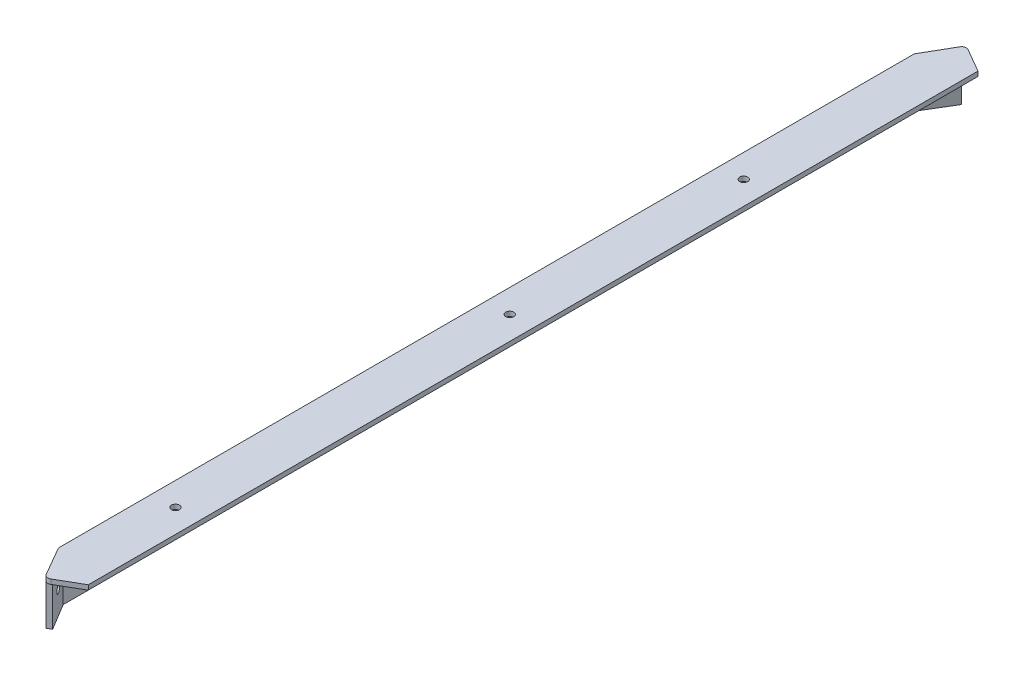
from build123d import *

# Parameters (mm, degrees)
BOSS_EXTRUDE1_DEPTH = 640
BOSS_EXTRUDE2_DEPTH = 63
BOSS_EXTRUDE4_DEPTH = 7
SKETCH10_R          = 6
CUT_EXTRUDE3_DEPTH  = 7
FILLET5_R           = 5
SKETCH22_R          = 6
CUT_EXTRUDE4_DEPTH  = 335


with BuildPart() as part:
    # Sketch1 → Boss-Extrude1 (new body)
    with BuildSketch(Plane.XY):
        Polygon((0, 0), (0, 70), (70, 70), (70, 63), (7, 63), (7, 0), align=None)
    extrude(amount=BOSS_EXTRUDE1_DEPTH)

    # Sketch2 → Boss-Extrude2 (add)
    with BuildSketch(Plane(origin=(0, 0, 0), x_dir=(1, 0, 0), z_dir=(0, 1, 0))):
        Polygon((0, -640), (25, -683.301270189), (31.062177826, -679.801270189), (7, -640), align=None)
    extrude(amount=BOSS_EXTRUDE2_DEPTH)

    # Sketch9 → Boss-Extrude4 (add)
    with BuildSketch(Plane(origin=(0, 63, 0), x_dir=(1, 0, 0), z_dir=(0, 1, 0))):
        with BuildLine():
            Line((0, -640), (25, -683.301270189))
            ThreePointArc((25, -683.301270189), (29.250444511, -686.562750973), (34.562177826, -685.863448016))
            Line((34.562177826, -685.863448016), (70, -665.403411844))
            Line((70, -665.403411844), (70, -640))
            Line((70, -640), (0, -640))
        make_face()
    extrude(amount=BOSS_EXTRUDE4_DEPTH)

    # Sketch10 → Cut-Extrude3 (cut)
    with BuildSketch(Plane(origin=(-278.227615862, 0, 168.20474164), x_dir=(-0.5173609804017633, 0, -0.8557672674026079), z_dir=(0.8557672674026079, 0, -0.5173609804017633))):
        with Locations((-572.82203414, 35)):
            Circle(SKETCH10_R)
    extrude(amount=-CUT_EXTRUDE3_DEPTH, mode=Mode.SUBTRACT)

    # Fillet5
    fillet5_edges = [part.edges().sort_by_distance(p)[0] for p in [
        (7, 63, 320),
        (19.031088913, 63, 659.900635095),
    ]]
    fillet(fillet5_edges, radius=FILLET5_R)

    # Mirror6: part across plane


with BuildPart() as part_1:
    add(part.part)
    add(part.part.mirror(Plane.XY))

    # Sketch22 → Cut-Extrude4 (cut)
    with BuildSketch(Plane(origin=(0, 70, 0), x_dir=(1, 0, 0), z_dir=(0, 1, 0))):
        with Locations(Location((35, 0, 0), (0, 0, 270))):
            Circle(SKETCH22_R)
        with Locations(Location((35, 350, 0), (0, 0, 270))):
            Circle(SKETCH22_R)
        with Locations(Location((35, -500, 0), (0, 0, 270))):
            Circle(SKETCH22_R)
    extrude(amount=-CUT_EXTRUDE4_DEPTH, mode=Mode.SUBTRACT)


solid = part_1.part
